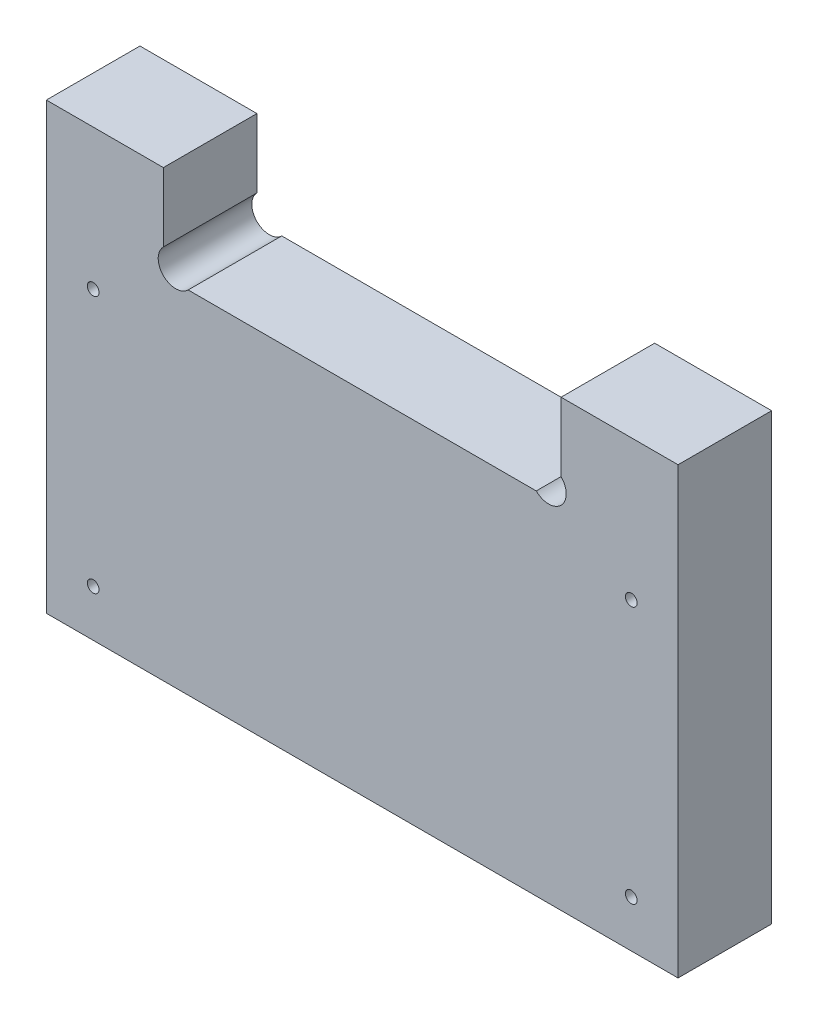
from build123d import *

# Parameters (mm, degrees)
BOSS_EXTRU_1_DEPTH      = 8
ESQUISSE2_R             = 0.5
ENL_V_MAT_EXTRU_1_DEPTH = 8


with BuildPart() as part:
    # Esquisse1 → Boss.-Extru.1 (new body)
    with BuildSketch(Plane.XY):
        with BuildLine():
            Line((-114.826935211, -6.347820711), (-114.826935211, -44.347820711))
            Line((-114.826935211, -44.347820711), (-60.826935211, -44.347820711))
            Line((-60.826935211, -44.347820711), (-60.826935211, -6.347820711))
            Line((-60.826935211, -6.347820711), (-70.826935211, -6.347820711))
            Line((-70.826935211, -6.347820711), (-70.826935211, -12.226500367))
            ThreePointArc((-70.826935211, -12.226500367), (-70.826935211, -14.347820711), (-72.948255555, -14.347820711))
            Line((-72.948255555, -14.347820711), (-102.705614868, -14.347820711))
            ThreePointArc((-102.705614868, -14.347820711), (-104.826935211, -14.347820711), (-104.826935211, -12.226500367))
            Line((-104.826935211, -12.226500367), (-104.826935211, -6.347820711))
            Line((-104.826935211, -6.347820711), (-114.826935211, -6.347820711))
        make_face()
    extrude(amount=BOSS_EXTRU_1_DEPTH)

    # Esquisse2 → Enlèv. mat.-Extru.1 (cut)
    with BuildSketch(Plane.XY.offset(8)):
        with Locations((-110.826935211, -18.347820711)):
            Circle(ESQUISSE2_R)
        with Locations((-64.826935211, -18.347820711)):
            Circle(ESQUISSE2_R)
        with Locations((-64.826935211, -40.347820711)):
            Circle(ESQUISSE2_R)
        with Locations((-110.826935211, -40.347820711)):
            Circle(ESQUISSE2_R)
    extrude(amount=-ENL_V_MAT_EXTRU_1_DEPTH, mode=Mode.SUBTRACT)


solid = part.part
